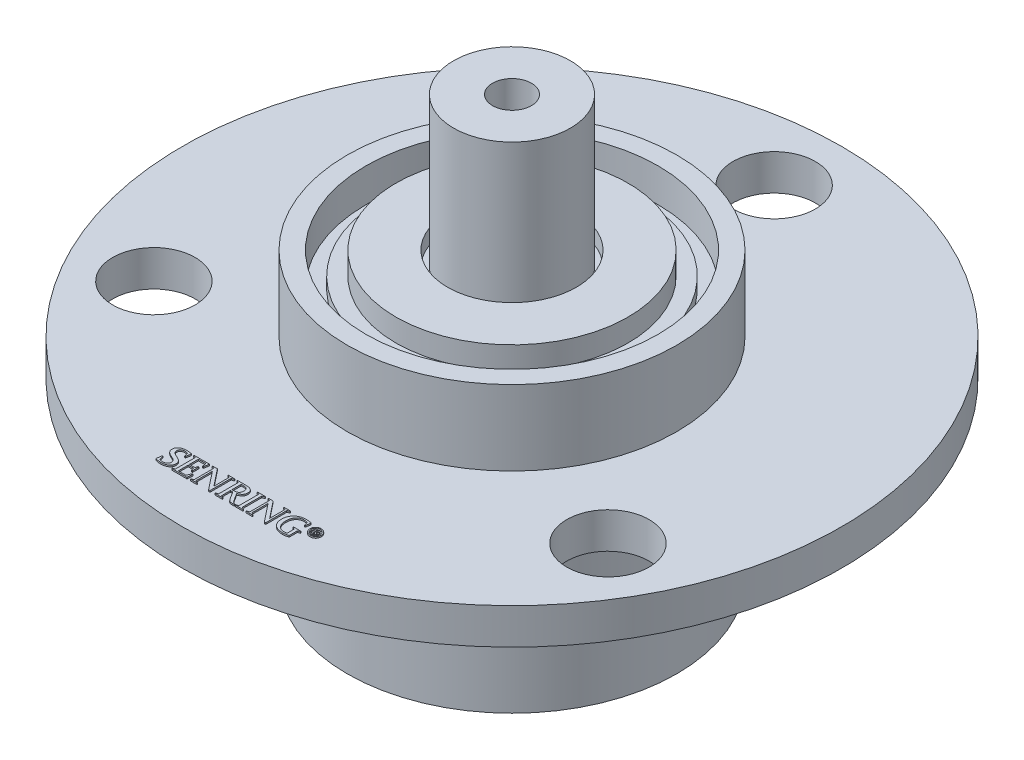
from build123d import *

# Parameters (mm, degrees)
SKETCH1_R           = 22
BOSS_EXTRUDE1_DEPTH = 2.4
SKETCH2_R           = 11
BOSS_EXTRUDE2_DEPTH = 5
BOSS_EXTRUDE3_START = 11.6
SKETCH3_R           = 11
BOSS_EXTRUDE3_DEPTH = 11.6
SKETCH4_R           = 2.75
CUT_EXTRUDE1_DEPTH  = 2.4
SKETCH5_R           = 9.75
SKETCH5_R_2         = 7.75
CUT_EXTRUDE2_DEPTH  = 1.5
SKETCH6_R           = 3.9
BOSS_EXTRUDE4_DEPTH = 9
SKETCH7_R           = 9.75
SKETCH7_R_2         = 8.75
CUT_EXTRUDE3_DEPTH  = 0.75
BOSS_EXTRUDE5_DEPTH = 0.1
SKETCH9_R           = 9.4
CUT_EXTRUDE4_DEPTH  = 0.3
CUT_EXTRUDE5_DEPTH  = 6
SKETCH11_R          = 1.3
CUT_EXTRUDE6_DEPTH  = 3
CUT_EXTRUDE7_START  = -1
SKETCH12_R          = 4.3
SKETCH12_R_2        = 3.9
CUT_EXTRUDE7_DEPTH  = 1


with BuildPart() as part:
    # Sketch1 → Boss-Extrude1 (new body)
    with BuildSketch(Plane(origin=(0, 0, 0), x_dir=(1, 0, 0), z_dir=(0, 1, 0))):
        with Locations(Location((0, 0, 0), (0, 0, 270))):
            Circle(SKETCH1_R)
    extrude(amount=BOSS_EXTRUDE1_DEPTH)

    # Sketch2 → Boss-Extrude2 (add)
    with BuildSketch(Plane(origin=(0, 2.4, 0), x_dir=(1, 0, 0), z_dir=(0, 1, 0))):
        with Locations(Location((0, 0, 0), (0, 0, 270))):
            Circle(SKETCH2_R)
    extrude(amount=BOSS_EXTRUDE2_DEPTH)

    # Sketch3 → Boss-Extrude3 (add)
    with BuildSketch(Plane.XZ.offset(BOSS_EXTRUDE3_START)):
        with Locations(Location((0, 0, 0), (0, 0, 90))):
            Circle(SKETCH3_R)
    extrude(amount=-BOSS_EXTRUDE3_DEPTH)

    # Sketch4 → Cut-Extrude1 (cut)
    with BuildSketch(Plane(origin=(0, 2.4, 0), x_dir=(1, 0, 0), z_dir=(0, 1, 0))):
        with Locations(Location((0, 17.5, 0), (0, 0, 270))):
            Circle(SKETCH4_R)
        with Locations(Location((15.155444566, -8.75, 0), (0, 0, 270))):
            Circle(SKETCH4_R)
        with Locations(Location((-15.155444566, -8.75, 0), (0, 0, 270))):
            Circle(SKETCH4_R)
    extrude(amount=-CUT_EXTRUDE1_DEPTH, mode=Mode.SUBTRACT)

    # Sketch5 → Cut-Extrude2 (cut)
    with BuildSketch(Plane(origin=(0, 7.4, 0), x_dir=(1, 0, 0), z_dir=(0, 1, 0))):
        with Locations(Location((0, 0, 0), (0, 0, 270))):
            Circle(SKETCH5_R)
        with Locations(Location((0, 0, 0), (0, 0, 270))):
            Circle(SKETCH5_R_2, mode=Mode.SUBTRACT)
    extrude(amount=-CUT_EXTRUDE2_DEPTH, mode=Mode.SUBTRACT)

    # Sketch6 → Boss-Extrude4 (add)
    with BuildSketch(Plane(origin=(0, 7.4, 0), x_dir=(1, 0, 0), z_dir=(0, 1, 0))):
        with Locations(Location((0, 0, 0), (0, 0, 270))):
            Circle(SKETCH6_R)
    extrude(amount=BOSS_EXTRUDE4_DEPTH)

    # Sketch7 → Cut-Extrude3 (cut)
    with BuildSketch(Plane(origin=(0, 5.9, 0), x_dir=(1, 0, 0), z_dir=(0, 1, 0))):
        with Locations(Location((0, 0, 0), (0, 0, 270))):
            Circle(SKETCH7_R)
        with Locations(Location((0, 0, 0), (0, 0, 270))):
            Circle(SKETCH7_R_2, mode=Mode.SUBTRACT)
    extrude(amount=-CUT_EXTRUDE3_DEPTH, mode=Mode.SUBTRACT)

    # Sketch8 → Boss-Extrude5 (add)
    # profile 1 of 9: a face of its own
    with BuildSketch(Plane(origin=(0, 2.4, 0), x_dir=(1, 0, 0), z_dir=(0, 1, 0))):
        with BuildLine():
            add(Edge.make_bspline(
                [(-3.990424377, -17.672699904), (-4.008373633, -17.667217667), (-4.043350728, -17.656534622), (-4.095515267, -17.645512525), (-4.145415963, -17.638028046), (-4.17800345, -17.637176703), (-4.193861877, -17.636762404)],
                knots=[0, 0, 0, 0, 1.085488502, 2.115253907, 3.082804142, 4, 4, 4, 4], degree=3))
            add(Edge.make_bspline(
                [(-4.193861877, -17.636762404), (-4.205224969, -17.63690072), (-4.227372066, -17.637170305), (-4.25961526, -17.640467874), (-4.290160656, -17.645303529), (-4.318859045, -17.652567871), (-4.345943562, -17.661480846), (-4.371034073, -17.672942141), (-4.394654563, -17.685922587), (-4.416082548, -17.701313676), (-4.435697457, -17.718127914), (-4.452528741, -17.736878609), (-4.466836132, -17.757266567), (-4.478683872, -17.779027132), (-4.487982435, -17.802506516), (-4.493913159, -17.82768726), (-4.498308032, -17.854318812), (-4.498674418, -17.872680339), (-4.498861877, -17.882074904)],
                knots=[0, 0, 0, 0, 1.234208642, 2.405519354, 3.51827187, 4.591643104, 5.618907388, 6.611863802, 7.584813727, 8.542701907, 9.473318954, 10.386986489, 11.272527839, 12.174055887, 13.073663442, 14.007029733, 14.980308792, 16, 16, 16, 16], degree=3))
            add(Edge.make_bspline(
                [(-4.498861877, -17.882074904), (-4.498502135, -17.893450959), (-4.497804877, -17.915500247), (-4.492387415, -17.947537955), (-4.483392207, -17.977429677), (-4.470453694, -18.005098959), (-4.45409719, -18.030528119), (-4.435829519, -18.05468965), (-4.414546246, -18.076959489), (-4.383020937, -18.105125419), (-4.337844345, -18.136442628), (-4.278379837, -18.169380926), (-4.214669942, -18.199673552), (-4.171179165, -18.219528836), (-4.149174377, -18.229574904)],
                knots=[0, 0, 0, 0, 0.778259039, 1.508436541, 2.216563713, 2.908683688, 3.591078706, 4.282647702, 4.978612309, 5.695584281, 7.173255772, 8.727829764, 10.344398109, 12, 12, 12, 12], degree=3))
            add(Edge.make_bspline(
                [(-4.149174377, -18.229574904), (-4.124924871, -18.240441003), (-4.076823274, -18.261995123), (-4.006857753, -18.297073887), (-3.940441984, -18.33527304), (-3.890594206, -18.373465105), (-3.854645948, -18.407193223), (-3.830813757, -18.435208947), (-3.809793714, -18.465687798), (-3.791590842, -18.49856442), (-3.77659605, -18.534047045), (-3.766493277, -18.572560974), (-3.760082151, -18.613735359), (-3.759276178, -18.642154065), (-3.758861877, -18.656762404)],
                knots=[0, 0, 0, 0, 1.543398054, 3.0615021, 4.545469272, 5.98688264, 6.697343335, 7.405507011, 8.118847824, 8.844680014, 9.585218838, 10.349959468, 11.151813912, 12, 12, 12, 12], degree=3))
            add(Edge.make_bspline(
                [(-3.758861877, -18.656762404), (-3.759254602, -18.674091193), (-3.76002105, -18.70791036), (-3.768539248, -18.756947358), (-3.781487496, -18.802991786), (-3.800062012, -18.845902855), (-3.824088693, -18.885486639), (-3.852956199, -18.922251682), (-3.887901203, -18.955018604), (-3.927196003, -18.984933588), (-3.970629315, -19.011370035), (-4.017383826, -19.03412655), (-4.066929975, -19.053510297), (-4.119240643, -19.069520903), (-4.17445209, -19.081577196), (-4.232492455, -19.090282611), (-4.293448013, -19.09567041), (-4.33510068, -19.096393374), (-4.356361877, -19.096762404)],
                knots=[0, 0, 0, 0, 0.995693307, 1.943212381, 2.853401529, 3.741575323, 4.623157416, 5.510178669, 6.421254701, 7.370287868, 8.346430534, 9.34050028, 10.357381684, 11.403528079, 12.483557003, 13.604551818, 14.777266867, 16, 16, 16, 16], degree=3))
            add(Edge.make_bspline(
                [(-4.356361877, -19.096762404), (-4.38514545, -19.095987848), (-4.444259911, -19.094397098), (-4.535064475, -19.082627706), (-4.630325585, -19.064801644), (-4.694589794, -19.047518384), (-4.727611877, -19.038637404)],
                knots=[0, 0, 0, 0, 0.916293707, 1.881844505, 2.911588482, 4, 4, 4, 4], degree=3))
            Line((-4.727611877, -19.038637404), (-4.733861877, -19.030199904))
            Line((-4.733861877, -19.030199904), (-4.682299377, -18.664262404))
            Line((-4.682299377, -18.664262404), (-4.634799377, -18.656762404))
            Line((-4.634799377, -18.656762404), (-4.561049377, -18.953012404))
            add(Edge.make_bspline(
                [(-4.561049377, -18.953012404), (-4.54240938, -18.959721483), (-4.505405189, -18.973040373), (-4.448133926, -18.986680179), (-4.390257612, -18.995053168), (-4.3513896, -18.99619327), (-4.331986877, -18.996762404)],
                knots=[0, 0, 0, 0, 1.013176663, 2.01136215, 3.007281639, 4, 4, 4, 4], degree=3))
            add(Edge.make_bspline(
                [(-4.331986877, -18.996762404), (-4.319268633, -18.996649912), (-4.294407055, -18.996430014), (-4.258317197, -18.992765706), (-4.224240493, -18.987618994), (-4.192506196, -18.980097936), (-4.162699376, -18.970815491), (-4.135337771, -18.958934643), (-4.110002894, -18.945046609), (-4.086800467, -18.929220042), (-4.066223991, -18.91108162), (-4.048164217, -18.891180565), (-4.032747721, -18.869526136), (-4.020074909, -18.84596042), (-4.010861264, -18.820395102), (-4.003980644, -18.793296143), (-3.999358629, -18.764419283), (-3.999030336, -18.74448926), (-3.998861877, -18.734262404)],
                knots=[0, 0, 0, 0, 1.270299755, 2.483177503, 3.621207158, 4.711934724, 5.739017396, 6.736776301, 7.687149045, 8.622641224, 9.537225582, 10.421574316, 11.302485812, 12.187263261, 13.086374941, 14.010388254, 14.979054274, 16, 16, 16, 16], degree=3))
            add(Edge.make_bspline(
                [(-3.998861877, -18.734262404), (-3.999231274, -18.723096309), (-3.999950307, -18.701361495), (-4.005267232, -18.669814464), (-4.014441691, -18.640438447), (-4.027051673, -18.613091858), (-4.042690865, -18.587768567), (-4.061135345, -18.564592264), (-4.081400056, -18.542670542), (-4.112979988, -18.516496152), (-4.156871071, -18.485957429), (-4.215392229, -18.454325331), (-4.277849194, -18.424086812), (-4.320602121, -18.404302838), (-4.342299377, -18.394262404)],
                knots=[0, 0, 0, 0, 0.779269004, 1.516847907, 2.225209504, 2.92148785, 3.61365338, 4.297325759, 4.98662073, 5.693300865, 7.155751331, 8.71165789, 10.331155278, 12, 12, 12, 12], degree=3))
            add(Edge.make_bspline(
                [(-4.342299377, -18.394262404), (-4.366858696, -18.38329546), (-4.415749003, -18.361463536), (-4.487006682, -18.325849562), (-4.553753093, -18.285039685), (-4.605073155, -18.246230964), (-4.641163297, -18.210538877), (-4.665903869, -18.181460911), (-4.686943268, -18.149010837), (-4.705680008, -18.114171747), (-4.7208246, -18.076213076), (-4.73134142, -18.034942633), (-4.73760607, -17.990704843), (-4.738435945, -17.960220779), (-4.738861877, -17.944574904)],
                knots=[0, 0, 0, 0, 1.505590493, 2.997183208, 4.45523457, 5.880494019, 6.585539522, 7.293280273, 8.012930273, 8.745897636, 9.504910951, 10.294054083, 11.12442722, 12, 12, 12, 12], degree=3))
            add(Edge.make_bspline(
                [(-4.738861877, -17.944574904), (-4.738434304, -17.928809355), (-4.737596247, -17.897908299), (-4.729474357, -17.853014445), (-4.716840539, -17.810665386), (-4.698375355, -17.771435745), (-4.675504193, -17.73456031), (-4.646659898, -17.701093922), (-4.612874233, -17.670304566), (-4.574517562, -17.642411169), (-4.532521306, -17.617694857), (-4.487864578, -17.5960413), (-4.440976758, -17.577587201), (-4.391849543, -17.562625338), (-4.340544821, -17.551078841), (-4.287008443, -17.542639947), (-4.231148199, -17.537569957), (-4.19314325, -17.537034209), (-4.173861877, -17.536762404)],
                knots=[0, 0, 0, 0, 0.969870177, 1.900981247, 2.799786438, 3.683637421, 4.562727952, 5.463658981, 6.394306014, 7.371865646, 8.378371075, 9.390988941, 10.424835136, 11.477842863, 12.549919072, 13.660298415, 14.812979307, 16, 16, 16, 16], degree=3))
            add(Edge.make_bspline(
                [(-4.173861877, -17.536762404), (-4.145719011, -17.537244462), (-4.088711992, -17.538220935), (-4.002378894, -17.546279246), (-3.913934286, -17.558063667), (-3.854840691, -17.570253154), (-3.824799377, -17.576449904)],
                knots=[0, 0, 0, 0, 0.959381208, 1.943350944, 2.954464664, 4, 4, 4, 4], degree=3))
            Line((-3.824799377, -17.576449904), (-3.817299377, -17.584262404))
            Line((-3.817299377, -17.584262404), (-3.879799377, -17.919887404))
            Line((-3.879799377, -17.919887404), (-3.921986877, -17.927387404))
            Line((-3.921986877, -17.927387404), (-3.990424377, -17.672699904))
        make_face()
    # profile 2 of 9: a face of its own
    with BuildSketch(Plane(origin=(0, 2.4, 0), x_dir=(1, 0, 0), z_dir=(0, 1, 0))):
        with BuildLine():
            Line((-3.381049377, -17.576762404), (-3.127924377, -17.576762404))
            add(Edge.make_bspline(
                [(-3.127924377, -17.576762404), (-3.088028506, -17.576673943), (-3.007090541, -17.57649448), (-2.884067988, -17.575926939), (-2.75771209, -17.574677707), (-2.672402999, -17.57336506), (-2.629174377, -17.572699904)],
                knots=[0, 0, 0, 0, 0.95986119, 1.947299551, 2.95983638, 4, 4, 4, 4], degree=3))
            Line((-2.629174377, -17.572699904), (-2.622611877, -17.581137404))
            Line((-2.622611877, -17.581137404), (-2.683861877, -17.916762404))
            Line((-2.683861877, -17.916762404), (-2.726049377, -17.923949904))
            Line((-2.726049377, -17.923949904), (-2.791361877, -17.656762404))
            Line((-2.791361877, -17.656762404), (-3.278861877, -17.656762404))
            Line((-3.278861877, -17.656762404), (-3.278861877, -18.256762404))
            Line((-3.278861877, -18.256762404), (-3.182924377, -18.256762404))
            add(Edge.make_bspline(
                [(-3.182924377, -18.256762404), (-3.164069854, -18.25682422), (-3.125422196, -18.256950931), (-3.065843292, -18.255944959), (-3.003128994, -18.256014914), (-2.960215414, -18.255269284), (-2.938236877, -18.254887404)],
                knots=[0, 0, 0, 0, 0.924608237, 1.895245239, 2.922032839, 4, 4, 4, 4], degree=3))
            add(Edge.make_bspline(
                [(-2.938236877, -18.254887404), (-2.934005966, -18.254530542), (-2.925938836, -18.253850111), (-2.915195358, -18.248592555), (-2.906707833, -18.240326329), (-2.903815018, -18.233066217), (-2.902299377, -18.229262404)],
                knots=[0, 0, 0, 0, 1.068716211, 2.037734312, 2.971903963, 4, 4, 4, 4], degree=3))
            Line((-2.902299377, -18.229262404), (-2.865424377, -18.096762404))
            Line((-2.865424377, -18.096762404), (-2.808236877, -18.094574904))
            add(Edge.make_bspline(
                [(-2.808236877, -18.094574904), (-2.808799338, -18.117386589), (-2.809844578, -18.159778298), (-2.810695354, -18.218532356), (-2.811383112, -18.267698608), (-2.811584377, -18.29728309), (-2.811674377, -18.310512404)],
                knots=[0, 0, 0, 0, 1.267879065, 2.356141637, 3.264914697, 4, 4, 4, 4], degree=3))
            add(Edge.make_bspline(
                [(-2.811674377, -18.310512404), (-2.811583882, -18.323429215), (-2.811380265, -18.352492859), (-2.810694777, -18.400929952), (-2.809843512, -18.459059037), (-2.808799222, -18.501034058), (-2.808236877, -18.523637404)],
                knots=[0, 0, 0, 0, 0.727191112, 1.636226109, 2.727119176, 4, 4, 4, 4], degree=3))
            Line((-2.808236877, -18.523637404), (-2.865424377, -18.527699904))
            Line((-2.865424377, -18.527699904), (-2.903236877, -18.370199904))
            add(Edge.make_bspline(
                [(-2.903236877, -18.370199904), (-2.904785897, -18.36572278), (-2.907654558, -18.357431508), (-2.914933625, -18.347199339), (-2.924739019, -18.340550534), (-2.932202472, -18.339494314), (-2.936049377, -18.338949904)],
                knots=[0, 0, 0, 0, 1.165841965, 2.159045699, 3.051112636, 4, 4, 4, 4], degree=3))
            add(Edge.make_bspline(
                [(-2.936049377, -18.338949904), (-2.958340704, -18.338606226), (-3.00188064, -18.337934946), (-3.065529223, -18.337475325), (-3.125839084, -18.336599867), (-3.164903256, -18.336709296), (-3.183861877, -18.336762404)],
                knots=[0, 0, 0, 0, 1.079495133, 2.108494915, 3.082014899, 4, 4, 4, 4], degree=3))
            Line((-3.183861877, -18.336762404), (-3.278861877, -18.336762404))
            Line((-3.278861877, -18.336762404), (-3.278861877, -18.748949904))
            add(Edge.make_bspline(
                [(-3.278861877, -18.748949904), (-3.278733812, -18.790513114), (-3.278479279, -18.873121482), (-3.27727349, -18.95572143), (-3.276674377, -18.996762404)],
                knots=[0, 0, 0, 0, 1.006271195, 2, 2, 2, 2], degree=3))
            Line((-3.276674377, -18.996762404), (-2.770424377, -18.996762404))
            Line((-2.770424377, -18.996762404), (-2.641674377, -18.704262404))
            Line((-2.641674377, -18.704262404), (-2.594174377, -18.695824904))
            Line((-2.594174377, -18.695824904), (-2.617611877, -19.072387404))
            Line((-2.617611877, -19.072387404), (-2.624799377, -19.079887404))
            add(Edge.make_bspline(
                [(-2.624799377, -19.079887404), (-2.669487071, -19.079499768), (-2.756987619, -19.078740759), (-2.885629231, -19.077133935), (-3.008966435, -19.077143092), (-3.089487001, -19.076887426), (-3.128861877, -19.076762404)],
                knots=[0, 0, 0, 0, 1.063875567, 2.083116964, 3.062636615, 4, 4, 4, 4], degree=3))
            Line((-3.128861877, -19.076762404), (-3.376674377, -19.076762404))
            add(Edge.make_bspline(
                [(-3.376674377, -19.076762404), (-3.418966043, -19.076762404), (-3.505111877, -19.076762404), (-3.59125771, -19.076762404), (-3.635111877, -19.076762404)],
                knots=[0, 0, 0, 0, 0.981862152, 2, 2, 2, 2], degree=3))
            Line((-3.635111877, -19.076762404), (-3.639174377, -19.036762404))
            Line((-3.639174377, -19.036762404), (-3.509486877, -18.996762404))
            add(Edge.make_bspline(
                [(-3.509486877, -18.996762404), (-3.505520348, -18.99531474), (-3.497988354, -18.992565789), (-3.488784833, -18.985108632), (-3.482644324, -18.975062913), (-3.481599182, -18.967371198), (-3.481049377, -18.963324904)],
                knots=[0, 0, 0, 0, 1.072356029, 2.036284212, 2.966969876, 4, 4, 4, 4], degree=3))
            add(Edge.make_bspline(
                [(-3.481049377, -18.963324904), (-3.480703834, -18.948117091), (-3.479974932, -18.916037133), (-3.479518942, -18.865199597), (-3.478670429, -18.808952199), (-3.478796068, -18.769575295), (-3.478861877, -18.748949904)],
                knots=[0, 0, 0, 0, 0.851424291, 1.796027954, 2.845572385, 4, 4, 4, 4], degree=3))
            Line((-3.478861877, -18.748949904), (-3.478861877, -17.874574904))
            add(Edge.make_bspline(
                [(-3.478861877, -17.874574904), (-3.478794862, -17.857178591), (-3.478667648, -17.824155459), (-3.479519262, -17.777075284), (-3.479972394, -17.734778495), (-3.480703689, -17.70811594), (-3.481049377, -17.695512404)],
                knots=[0, 0, 0, 0, 1.165661162, 2.212755269, 3.155159611, 4, 4, 4, 4], degree=3))
            add(Edge.make_bspline(
                [(-3.481049377, -17.695512404), (-3.481386368, -17.69116887), (-3.482021619, -17.682981021), (-3.487438281, -17.672145148), (-3.495432467, -17.663429194), (-3.502655567, -17.660468891), (-3.506361877, -17.658949904)],
                knots=[0, 0, 0, 0, 1.089053236, 2.052937975, 3.000925474, 4, 4, 4, 4], degree=3))
            Line((-3.506361877, -17.658949904), (-3.636986877, -17.616762404))
            Line((-3.636986877, -17.616762404), (-3.639174377, -17.576762404))
            add(Edge.make_bspline(
                [(-3.639174377, -17.576762404), (-3.59500771, -17.576762404), (-3.508966043, -17.576762404), (-3.422924377, -17.576762404), (-3.381049377, -17.576762404)],
                knots=[0, 0, 0, 0, 1.026634383, 2, 2, 2, 2], degree=3))
        make_face()
    # profile 3 of 9: a face of its own
    with BuildSketch(Plane(origin=(0, 2.4, 0), x_dir=(1, 0, 0), z_dir=(0, 1, 0))):
        with BuildLine():
            Line((-2.118861877, -17.882074904), (-2.118861877, -18.751449904))
            add(Edge.make_bspline(
                [(-2.118861877, -18.751449904), (-2.118927981, -18.771762805), (-2.119054091, -18.810514747), (-2.118202236, -18.865928724), (-2.117753, -18.915933105), (-2.117020231, -18.947492106), (-2.116674377, -18.962387404)],
                knots=[0, 0, 0, 0, 1.155460956, 2.204330929, 3.152475522, 4, 4, 4, 4], degree=3))
            add(Edge.make_bspline(
                [(-2.116674377, -18.962387404), (-2.116381217, -18.967051317), (-2.115837108, -18.975707602), (-2.110192916, -18.986820724), (-2.10175349, -18.995303194), (-2.094346383, -18.997687455), (-2.090424377, -18.998949904)],
                knots=[0, 0, 0, 0, 1.13809326, 2.112316129, 3.00048572, 4, 4, 4, 4], degree=3))
            Line((-2.090424377, -18.998949904), (-1.964799377, -19.036762404))
            Line((-1.964799377, -19.036762404), (-1.962924377, -19.076762404))
            add(Edge.make_bspline(
                [(-1.962924377, -19.076762404), (-1.983862525, -19.076385537), (-2.023656294, -19.075669288), (-2.080416692, -19.074032201), (-2.131154404, -19.074023309), (-2.163028787, -19.073760309), (-2.177924377, -19.073637404)],
                knots=[0, 0, 0, 0, 1.168682208, 2.221126205, 3.168693739, 4, 4, 4, 4], degree=3))
            add(Edge.make_bspline(
                [(-2.177924377, -19.073637404), (-2.192507478, -19.07375984), (-2.224069364, -19.074024826), (-2.274806879, -19.074038098), (-2.332504788, -19.075680697), (-2.373236194, -19.076387972), (-2.394799377, -19.076762404)],
                knots=[0, 0, 0, 0, 0.806833825, 1.746212635, 2.806846289, 4, 4, 4, 4], degree=3))
            Line((-2.394799377, -19.076762404), (-2.399174377, -19.036762404))
            Line((-2.399174377, -19.036762404), (-2.269174377, -18.996762404))
            add(Edge.make_bspline(
                [(-2.269174377, -18.996762404), (-2.265102649, -18.99520717), (-2.257486774, -18.992298216), (-2.24817385, -18.984802682), (-2.242015634, -18.974870425), (-2.24117345, -18.967266594), (-2.240736877, -18.963324904)],
                knots=[0, 0, 0, 0, 1.106377687, 2.069400312, 2.999211647, 4, 4, 4, 4], degree=3))
            add(Edge.make_bspline(
                [(-2.240736877, -18.963324904), (-2.240398307, -18.947908692), (-2.239686901, -18.915516025), (-2.239108927, -18.86436795), (-2.238791324, -18.808325329), (-2.23883774, -18.76926245), (-2.238861877, -18.748949904)],
                knots=[0, 0, 0, 0, 0.863093851, 1.813539741, 2.863049087, 4, 4, 4, 4], degree=3))
            Line((-2.238861877, -18.748949904), (-2.238861877, -17.874574904))
            add(Edge.make_bspline(
                [(-2.238861877, -17.874574904), (-2.238837334, -17.857387343), (-2.23879033, -17.824470216), (-2.239109394, -17.777385789), (-2.239676856, -17.734882808), (-2.240397534, -17.708116002), (-2.240736877, -17.695512404)],
                knots=[0, 0, 0, 0, 1.151721508, 2.205744304, 3.155144676, 4, 4, 4, 4], degree=3))
            add(Edge.make_bspline(
                [(-2.240736877, -17.695512404), (-2.241238879, -17.691189029), (-2.242178383, -17.68309777), (-2.247046235, -17.672065223), (-2.255149203, -17.66344152), (-2.262352981, -17.660473071), (-2.266049377, -17.658949904)],
                knots=[0, 0, 0, 0, 1.095100481, 2.049496461, 2.999159568, 4, 4, 4, 4], degree=3))
            Line((-2.266049377, -17.658949904), (-2.396986877, -17.616762404))
            Line((-2.396986877, -17.616762404), (-2.399174377, -17.576762404))
            add(Edge.make_bspline(
                [(-2.399174377, -17.576762404), (-2.377612942, -17.577430806), (-2.336993402, -17.578690008), (-2.279591956, -17.579816097), (-2.229386776, -17.580931366), (-2.19823738, -17.581072343), (-2.183861877, -17.581137404)],
                knots=[0, 0, 0, 0, 1.201963383, 2.264376297, 3.199006451, 4, 4, 4, 4], degree=3))
            add(Edge.make_bspline(
                [(-2.183861877, -17.581137404), (-2.16791752, -17.580872059), (-2.13579233, -17.580337434), (-2.103750648, -17.577959914), (-2.087611877, -17.576762404)],
                knots=[0, 0, 0, 0, 0.992638928, 2, 2, 2, 2], degree=3))
            Line((-2.087611877, -17.576762404), (-1.198861877, -18.700824904))
            Line((-1.198861877, -18.700824904), (-1.198861877, -17.867387404))
            add(Edge.make_bspline(
                [(-1.198861877, -17.867387404), (-1.198797706, -17.850511948), (-1.198674114, -17.818009683), (-1.199525854, -17.771137826), (-1.199983715, -17.7279039), (-1.200704103, -17.700303475), (-1.201049377, -17.687074904)],
                knots=[0, 0, 0, 0, 1.122927161, 2.162766949, 3.119434984, 4, 4, 4, 4], degree=3))
            add(Edge.make_bspline(
                [(-1.201049377, -17.687074904), (-1.201539071, -17.68316213), (-1.202470913, -17.675716503), (-1.207753044, -17.665537245), (-1.216869272, -17.658117136), (-1.224277501, -17.65519771), (-1.228236877, -17.653637404)],
                knots=[0, 0, 0, 0, 1.018818456, 1.938712073, 2.89833145, 4, 4, 4, 4], degree=3))
            Line((-1.228236877, -17.653637404), (-1.352924377, -17.616762404))
            Line((-1.352924377, -17.616762404), (-1.354799377, -17.576762404))
            add(Edge.make_bspline(
                [(-1.354799377, -17.576762404), (-1.333446134, -17.577419949), (-1.292826639, -17.578670773), (-1.235324611, -17.579941011), (-1.184383852, -17.580537752), (-1.152716131, -17.58073348), (-1.137924377, -17.580824904)],
                knots=[0, 0, 0, 0, 1.181812028, 2.248117968, 3.181709099, 4, 4, 4, 4], degree=3))
            add(Edge.make_bspline(
                [(-1.137924377, -17.580824904), (-1.123028459, -17.580733468), (-1.091256574, -17.580538441), (-1.040523961, -17.579949568), (-0.983751088, -17.578673194), (-0.943860928, -17.577420098), (-0.922924377, -17.576762404)],
                knots=[0, 0, 0, 0, 0.831235264, 1.77296311, 2.831128506, 4, 4, 4, 4], degree=3))
            Line((-0.922924377, -17.576762404), (-0.918549377, -17.616762404))
            Line((-0.918549377, -17.616762404), (-1.051674377, -17.658637404))
            add(Edge.make_bspline(
                [(-1.051674377, -17.658637404), (-1.055343867, -17.660300167), (-1.062385685, -17.66349104), (-1.070779518, -17.67174472), (-1.07552418, -17.682808141), (-1.076477495, -17.690884494), (-1.076986877, -17.695199904)],
                knots=[0, 0, 0, 0, 1.014601308, 1.947038455, 2.903048032, 4, 4, 4, 4], degree=3))
            add(Edge.make_bspline(
                [(-1.076986877, -17.695199904), (-1.077362234, -17.707803112), (-1.078159363, -17.73456794), (-1.078074935, -17.776973706), (-1.07909051, -17.823946734), (-1.078940467, -17.856761791), (-1.078861877, -17.873949904)],
                knots=[0, 0, 0, 0, 0.846333692, 1.797318252, 2.846263156, 4, 4, 4, 4], degree=3))
            Line((-1.078861877, -17.873949904), (-1.078861877, -19.076762404))
            Line((-1.078861877, -19.076762404), (-1.167611877, -19.085199904))
            Line((-1.167611877, -19.085199904), (-2.118861877, -17.882074904))
        make_face()
    # profile 4 of 9: a face of its own
    with BuildSketch(Plane(origin=(0, 2.4, 0), x_dir=(1, 0, 0), z_dir=(0, 1, 0))):
        with BuildLine():
            add(Edge.make_bspline(
                [(-0.398861877, -18.757699904), (-0.398753209, -18.777491543), (-0.398546739, -18.815095717), (-0.398322169, -18.868638924), (-0.397723869, -18.916766325), (-0.397011994, -18.947075392), (-0.396674377, -18.961449904)],
                knots=[0, 0, 0, 0, 1.16556873, 2.214583996, 3.153240739, 4, 4, 4, 4], degree=3))
            add(Edge.make_bspline(
                [(-0.396674377, -18.961449904), (-0.396221865, -18.966405112), (-0.395372923, -18.975701414), (-0.389957822, -18.988153439), (-0.381036055, -18.997686314), (-0.373201638, -19.000791296), (-0.369174377, -19.002387404)],
                knots=[0, 0, 0, 0, 1.12342583, 2.107622107, 3.027228327, 4, 4, 4, 4], degree=3))
            Line((-0.369174377, -19.002387404), (-0.252299377, -19.036762404))
            Line((-0.252299377, -19.036762404), (-0.248861877, -19.076762404))
            add(Edge.make_bspline(
                [(-0.248861877, -19.076762404), (-0.29042241, -19.075772496), (-0.373014949, -19.073805268), (-0.455630793, -19.073693119), (-0.496674377, -19.073637404)],
                knots=[0, 0, 0, 0, 1.006399206, 2, 2, 2, 2], degree=3))
            add(Edge.make_bspline(
                [(-0.496674377, -19.073637404), (-0.538967791, -19.073699655), (-0.625124569, -19.073826468), (-0.71125959, -19.075771942), (-0.755111877, -19.076762404)],
                knots=[0, 0, 0, 0, 0.98177799, 2, 2, 2, 2], degree=3))
            Line((-0.755111877, -19.076762404), (-0.759174377, -19.036762404))
            Line((-0.759174377, -19.036762404), (-0.629486877, -18.996762404))
            add(Edge.make_bspline(
                [(-0.629486877, -18.996762404), (-0.625520348, -18.99531474), (-0.617988354, -18.992565789), (-0.608784833, -18.985108632), (-0.602644324, -18.975062913), (-0.601599182, -18.967371198), (-0.601049377, -18.963324904)],
                knots=[0, 0, 0, 0, 1.072356029, 2.036284212, 2.966969876, 4, 4, 4, 4], degree=3))
            add(Edge.make_bspline(
                [(-0.601049377, -18.963324904), (-0.600703834, -18.948117091), (-0.599974932, -18.916037133), (-0.599518942, -18.865199597), (-0.598670429, -18.808952199), (-0.598796068, -18.769575295), (-0.598861877, -18.748949904)],
                knots=[0, 0, 0, 0, 0.851424291, 1.796027954, 2.845572385, 4, 4, 4, 4], degree=3))
            Line((-0.598861877, -18.748949904), (-0.598861877, -17.874574904))
            add(Edge.make_bspline(
                [(-0.598861877, -17.874574904), (-0.598794862, -17.857178591), (-0.598667648, -17.824155459), (-0.599519262, -17.777075284), (-0.599972394, -17.734778495), (-0.600703689, -17.70811594), (-0.601049377, -17.695512404)],
                knots=[0, 0, 0, 0, 1.165661162, 2.212755269, 3.155159611, 4, 4, 4, 4], degree=3))
            add(Edge.make_bspline(
                [(-0.601049377, -17.695512404), (-0.601386368, -17.69116887), (-0.602021619, -17.682981021), (-0.607438281, -17.672145148), (-0.615432467, -17.663429194), (-0.622655567, -17.660468891), (-0.626361877, -17.658949904)],
                knots=[0, 0, 0, 0, 1.089053236, 2.052937975, 3.000925474, 4, 4, 4, 4], degree=3))
            Line((-0.626361877, -17.658949904), (-0.756986877, -17.616762404))
            Line((-0.756986877, -17.616762404), (-0.759174377, -17.576762404))
            add(Edge.make_bspline(
                [(-0.759174377, -17.576762404), (-0.714281306, -17.577986557), (-0.625235063, -17.580414687), (-0.536156215, -17.580688924), (-0.491986877, -17.580824904)],
                knots=[0, 0, 0, 0, 1.008309156, 2, 2, 2, 2], degree=3))
            add(Edge.make_bspline(
                [(-0.491986877, -17.580824904), (-0.482194022, -17.580773989), (-0.460309871, -17.580660209), (-0.423653751, -17.579132055), (-0.379187411, -17.577421141), (-0.346780725, -17.576994302), (-0.329174377, -17.576762404)],
                knots=[0, 0, 0, 0, 0.721468326, 1.612269701, 2.702761104, 4, 4, 4, 4], degree=3))
            add(Edge.make_bspline(
                [(-0.329174377, -17.576762404), (-0.311361877, -17.576762404), (-0.27907021, -17.576762404), (-0.235111877, -17.576762404), (-0.200111877, -17.576762404), (-0.179591043, -17.576762404), (-0.170736877, -17.576762404)],
                knots=[0, 0, 0, 0, 1.349112426, 2.445759369, 3.32938856, 4, 4, 4, 4], degree=3))
            add(Edge.make_bspline(
                [(-0.170736877, -17.576762404), (-0.150832605, -17.577064539), (-0.112327888, -17.577649019), (-0.056502589, -17.582067023), (-0.004521454, -17.589173666), (0.043717468, -17.598939997), (0.088019222, -17.612127588), (0.128520299, -17.628044781), (0.165403614, -17.646628434), (0.198011126, -17.668756857), (0.227143353, -17.693181813), (0.252240894, -17.720568959), (0.273752771, -17.750518184), (0.291380528, -17.783246383), (0.304851898, -17.818781053), (0.313964936, -17.856927057), (0.320266068, -17.897492183), (0.320841907, -17.925486734), (0.321138123, -17.939887404)],
                knots=[0, 0, 0, 0, 1.373939338, 2.657878926, 3.862977708, 4.994036763, 6.051984536, 7.049479102, 7.994998342, 8.896479064, 9.763814478, 10.613714993, 11.453824405, 12.303207606, 13.172627177, 14.069074787, 15.006713304, 16, 16, 16, 16], degree=3))
            add(Edge.make_bspline(
                [(0.321138123, -17.939887404), (0.32092217, -17.952917338), (0.320497794, -17.978522761), (0.31646014, -18.015967437), (0.309371066, -18.051396608), (0.300636599, -18.085157875), (0.288194616, -18.116722776), (0.273595873, -18.146673849), (0.25592219, -18.174503937), (0.23590218, -18.200713078), (0.21274214, -18.224751566), (0.187302616, -18.247806023), (0.158922391, -18.269335296), (0.127377484, -18.288970053), (0.093299074, -18.307323185), (0.056572903, -18.32467282), (0.016880452, -18.340266565), (-0.010890621, -18.349109193), (-0.025111877, -18.353637404)],
                knots=[0, 0, 0, 0, 1.066375877, 2.09555964, 3.077161004, 4.022426913, 4.945591025, 5.849334685, 6.745930503, 7.639602367, 8.544310879, 9.474066861, 10.447822873, 11.455591219, 12.512413436, 13.614760254, 14.778545442, 16, 16, 16, 16], degree=3))
            add(Edge.make_bspline(
                [(-0.025111877, -18.353637404), (-0.002816361, -18.38672899), (0.04066779, -18.451269303), (0.100445763, -18.547510699), (0.156486722, -18.637428822), (0.200434199, -18.707985399), (0.233768738, -18.760213164), (0.257229382, -18.796069498), (0.279363608, -18.829749114), (0.300131002, -18.861160902), (0.320425446, -18.889451694), (0.339616188, -18.914920464), (0.358490036, -18.936867203), (0.371088607, -18.950141685), (0.377075623, -18.956449904)],
                knots=[0, 0, 0, 0, 1.979920897, 3.861546963, 5.621521729, 7.237935787, 7.986456609, 8.696166828, 9.364277827, 9.986498717, 10.564574258, 11.09186048, 11.568439417, 12, 12, 12, 12], degree=3))
            add(Edge.make_bspline(
                [(0.377075623, -18.956449904), (0.382926754, -18.96216747), (0.394236194, -18.973218748), (0.412190974, -18.98786312), (0.430810105, -18.999770784), (0.450131818, -19.009750353), (0.470634087, -19.017114796), (0.491826841, -19.024749541), (0.51494171, -19.030725692), (0.530927815, -19.034693533), (0.539263123, -19.036762404)],
                knots=[0, 0, 0, 0, 1.066453224, 2.06130902, 3.01449663, 3.943871608, 4.889773601, 5.851918761, 6.879969814, 8, 8, 8, 8], degree=3))
            Line((0.539263123, -19.036762404), (0.542388123, -19.069887404))
            add(Edge.make_bspline(
                [(0.542388123, -19.069887404), (0.530207645, -19.071032244), (0.50701435, -19.073212177), (0.473532543, -19.074734045), (0.443243206, -19.076720842), (0.423953548, -19.076749116), (0.414888123, -19.076762404)],
                knots=[0, 0, 0, 0, 1.149186279, 2.188207784, 3.148524834, 4, 4, 4, 4], degree=3))
            add(Edge.make_bspline(
                [(0.414888123, -19.076762404), (0.401347559, -19.076576052), (0.375927059, -19.076226204), (0.340023582, -19.075404189), (0.308388797, -19.072240319), (0.280179827, -19.067460862), (0.254989726, -19.060004427), (0.231656463, -19.051393063), (0.209989121, -19.039769186), (0.196472317, -19.030535975), (0.189575623, -19.025824904)],
                knots=[0, 0, 0, 0, 1.380324856, 2.591365151, 3.658322977, 4.618350237, 5.502084813, 6.33215299, 7.149012595, 8, 8, 8, 8], degree=3))
            add(Edge.make_bspline(
                [(0.189575623, -19.025824904), (0.18195761, -19.020135335), (0.166186426, -19.008356512), (0.143965388, -18.987112116), (0.122269549, -18.962276058), (0.092252483, -18.923997213), (0.055523711, -18.869305795), (0.009989522, -18.798226097), (-0.037015444, -18.720714104), (-0.085766113, -18.638826687), (-0.13634053, -18.554953945), (-0.17320717, -18.500359705), (-0.191674377, -18.473012404)],
                knots=[0, 0, 0, 0, 0.422669588, 0.875031247, 1.364135484, 1.888822465, 3.037944898, 4.292504576, 5.644318377, 7.070000119, 8.532306861, 10, 10, 10, 10], degree=3))
            add(Edge.make_bspline(
                [(-0.191674377, -18.473012404), (-0.19670703, -18.465667635), (-0.205686338, -18.45256303), (-0.218891578, -18.435346312), (-0.230967381, -18.421577813), (-0.244501731, -18.411629572), (-0.259777262, -18.40448213), (-0.277618234, -18.400245797), (-0.299016697, -18.397967893), (-0.314585427, -18.397193005), (-0.323236877, -18.396762404)],
                knots=[0, 0, 0, 0, 1.317495967, 2.350688577, 3.212640675, 4.017539648, 4.817698653, 5.692790188, 6.71789732, 8, 8, 8, 8], degree=3))
            Line((-0.323236877, -18.396762404), (-0.398861877, -18.394887404))
            Line((-0.398861877, -18.394887404), (-0.398861877, -18.757699904))
        make_face()
        with BuildLine():
            add(Edge.make_bspline(
                [(-0.398861877, -18.293637404), (-0.377822786, -18.294468016), (-0.337420169, -18.296063091), (-0.296989058, -18.296535835), (-0.277611877, -18.296762404)],
                knots=[0, 0, 0, 0, 1.041471719, 2, 2, 2, 2], degree=3))
            add(Edge.make_bspline(
                [(-0.277611877, -18.296762404), (-0.262605717, -18.296508183), (-0.233593923, -18.296016692), (-0.191717285, -18.292670003), (-0.152948514, -18.286788382), (-0.117329703, -18.278359528), (-0.084598586, -18.26786939), (-0.054990767, -18.254757418), (-0.028610996, -18.239049873), (-0.005020744, -18.221095831), (0.015375296, -18.200277458), (0.03306491, -18.176827405), (0.048157974, -18.150735509), (0.060287757, -18.121828058), (0.069606632, -18.090255285), (0.076469501, -18.056072958), (0.080536462, -18.019152876), (0.080933595, -17.993647827), (0.081138123, -17.980512404)],
                knots=[0, 0, 0, 0, 1.305684408, 2.524313152, 3.652377692, 4.714230734, 5.705956491, 6.639127356, 7.525153036, 8.371777779, 9.21138698, 10.052511415, 10.921545616, 11.827241249, 12.773525228, 13.78139704, 14.857391325, 16, 16, 16, 16], degree=3))
            add(Edge.make_bspline(
                [(0.081138123, -17.980512404), (0.080952494, -17.967790033), (0.080592378, -17.943108926), (0.076283746, -17.907517382), (0.070281068, -17.874397733), (0.061304182, -17.843942274), (0.049299103, -17.816388109), (0.035242169, -17.791228815), (0.0181767, -17.768958532), (-0.0013522, -17.748994976), (-0.023774905, -17.731693231), (-0.049069832, -17.717003602), (-0.077141431, -17.704452042), (-0.108119749, -17.69417667), (-0.142154949, -17.68647285), (-0.179028189, -17.680958118), (-0.218796421, -17.677487634), (-0.246250333, -17.67700934), (-0.260424377, -17.676762404)],
                knots=[0, 0, 0, 0, 1.157306971, 2.245149082, 3.258555241, 4.21843618, 5.127231179, 5.98922298, 6.834949821, 7.672989047, 8.524488835, 9.404183157, 10.329300276, 11.318694509, 12.369721108, 13.501423902, 14.710022588, 16, 16, 16, 16], degree=3))
            add(Edge.make_bspline(
                [(-0.260424377, -17.676762404), (-0.270738669, -17.67691194), (-0.292210621, -17.67722324), (-0.325550186, -17.67889535), (-0.361409454, -17.681307637), (-0.386056396, -17.683869086), (-0.398861877, -17.685199904)],
                knots=[0, 0, 0, 0, 0.892071271, 1.8570843, 2.886634063, 4, 4, 4, 4], degree=3))
            Line((-0.398861877, -17.685199904), (-0.398861877, -18.293637404))
        make_face(mode=Mode.SUBTRACT)
    # profile 5 of 9: a face of its own
    with BuildSketch(Plane(origin=(0, 2.4, 0), x_dir=(1, 0, 0), z_dir=(0, 1, 0))):
        with BuildLine():
            add(Edge.make_bspline(
                [(0.961138123, -18.748949904), (0.961246957, -18.76947071), (0.96145468, -18.808637376), (0.961678512, -18.864576353), (0.962278824, -18.915203574), (0.962988228, -18.947179529), (0.963325623, -18.962387404)],
                knots=[0, 0, 0, 0, 1.153666349, 2.201924412, 3.144829081, 4, 4, 4, 4], degree=3))
            add(Edge.make_bspline(
                [(0.963325623, -18.962387404), (0.963922916, -18.966673801), (0.965085932, -18.975020043), (0.972969234, -18.985960787), (0.985063858, -18.994050056), (0.994880984, -18.997227909), (1.000200623, -18.998949904)],
                knots=[0, 0, 0, 0, 0.918546395, 1.788543708, 2.801670725, 4, 4, 4, 4], degree=3))
            Line((1.000200623, -18.998949904), (1.119575623, -19.036762404))
            Line((1.119575623, -19.036762404), (1.121450623, -19.076762404))
            add(Edge.make_bspline(
                [(1.121450623, -19.076762404), (1.077285834, -19.075771582), (0.991254758, -19.073841504), (0.905202311, -19.073704214), (0.863325623, -19.073637404)],
                knots=[0, 0, 0, 0, 1.02671712, 2, 2, 2, 2], degree=3))
            add(Edge.make_bspline(
                [(0.863325623, -19.073637404), (0.821032209, -19.073699655), (0.734875431, -19.073826468), (0.64874041, -19.075771942), (0.604888123, -19.076762404)],
                knots=[0, 0, 0, 0, 0.98177799, 2, 2, 2, 2], degree=3))
            Line((0.604888123, -19.076762404), (0.600825623, -19.036762404))
            Line((0.600825623, -19.036762404), (0.730513123, -18.996762404))
            add(Edge.make_bspline(
                [(0.730513123, -18.996762404), (0.734479652, -18.99531474), (0.742011646, -18.992565789), (0.751215167, -18.985108632), (0.757355676, -18.975062913), (0.758400818, -18.967371198), (0.758950623, -18.963324904)],
                knots=[0, 0, 0, 0, 1.072356029, 2.036284212, 2.966969876, 4, 4, 4, 4], degree=3))
            add(Edge.make_bspline(
                [(0.758950623, -18.963324904), (0.759296166, -18.948117091), (0.760025068, -18.916037133), (0.760481058, -18.865199597), (0.761329571, -18.808952199), (0.761203932, -18.769575295), (0.761138123, -18.748949904)],
                knots=[0, 0, 0, 0, 0.851424291, 1.796027954, 2.845572385, 4, 4, 4, 4], degree=3))
            Line((0.761138123, -18.748949904), (0.761138123, -17.874574904))
            add(Edge.make_bspline(
                [(0.761138123, -17.874574904), (0.761205138, -17.857178591), (0.761332352, -17.824155459), (0.760480738, -17.777075284), (0.760027606, -17.734778495), (0.759296311, -17.70811594), (0.758950623, -17.695512404)],
                knots=[0, 0, 0, 0, 1.165661162, 2.212755269, 3.155159611, 4, 4, 4, 4], degree=3))
            add(Edge.make_bspline(
                [(0.758950623, -17.695512404), (0.758613632, -17.69116887), (0.757978381, -17.682981021), (0.752561719, -17.672145148), (0.744567533, -17.663429194), (0.737344433, -17.660468891), (0.733638123, -17.658949904)],
                knots=[0, 0, 0, 0, 1.089053236, 2.052937975, 3.000925474, 4, 4, 4, 4], degree=3))
            Line((0.733638123, -17.658949904), (0.603013123, -17.616762404))
            Line((0.603013123, -17.616762404), (0.600825623, -17.576762404))
            add(Edge.make_bspline(
                [(0.600825623, -17.576762404), (0.644989453, -17.577986829), (0.731015118, -17.580371857), (0.817073075, -17.580676607), (0.858950623, -17.580824904)],
                knots=[0, 0, 0, 0, 1.026759394, 2, 2, 2, 2], degree=3))
            add(Edge.make_bspline(
                [(0.858950623, -17.580824904), (0.901036544, -17.580678996), (0.987198771, -17.580380281), (1.073328462, -17.577986793), (1.117388123, -17.576762404)],
                knots=[0, 0, 0, 0, 0.976899564, 2, 2, 2, 2], degree=3))
            Line((1.117388123, -17.576762404), (1.121450623, -17.616762404))
            Line((1.121450623, -17.616762404), (0.990825623, -17.656762404))
            add(Edge.make_bspline(
                [(0.990825623, -17.656762404), (0.986920796, -17.657933473), (0.979506747, -17.66015697), (0.970961764, -17.668092565), (0.964910002, -17.67814849), (0.963871885, -17.686044821), (0.963325623, -17.690199904)],
                knots=[0, 0, 0, 0, 1.036961333, 1.968866402, 2.93120901, 4, 4, 4, 4], degree=3))
            add(Edge.make_bspline(
                [(0.963325623, -17.690199904), (0.962988431, -17.703324375), (0.962281999, -17.730820704), (0.961685539, -17.773844082), (0.961454195, -17.820720766), (0.961246586, -17.853220767), (0.961138123, -17.870199904)],
                knots=[0, 0, 0, 0, 0.875161947, 1.833501708, 2.868145522, 4, 4, 4, 4], degree=3))
            Line((0.961138123, -17.870199904), (0.961138123, -18.748949904))
        make_face()
    # profile 6 of 9: a face of its own
    with BuildSketch(Plane(origin=(0, 2.4, 0), x_dir=(1, 0, 0), z_dir=(0, 1, 0))):
        with BuildLine():
            Line((1.601138123, -17.882074904), (1.601138123, -18.751449904))
            add(Edge.make_bspline(
                [(1.601138123, -18.751449904), (1.601072019, -18.771762805), (1.600945909, -18.810514747), (1.601797764, -18.865928724), (1.602247, -18.915933105), (1.602979769, -18.947492106), (1.603325623, -18.962387404)],
                knots=[0, 0, 0, 0, 1.155460956, 2.204330929, 3.152475522, 4, 4, 4, 4], degree=3))
            add(Edge.make_bspline(
                [(1.603325623, -18.962387404), (1.603618783, -18.967051317), (1.604162892, -18.975707602), (1.609807084, -18.986820724), (1.61824651, -18.995303194), (1.625653617, -18.997687455), (1.629575623, -18.998949904)],
                knots=[0, 0, 0, 0, 1.13809326, 2.112316129, 3.00048572, 4, 4, 4, 4], degree=3))
            Line((1.629575623, -18.998949904), (1.755200623, -19.036762404))
            Line((1.755200623, -19.036762404), (1.757075623, -19.076762404))
            add(Edge.make_bspline(
                [(1.757075623, -19.076762404), (1.736137475, -19.076385537), (1.696343706, -19.075669288), (1.639583308, -19.074032201), (1.588845596, -19.074023309), (1.556971213, -19.073760309), (1.542075623, -19.073637404)],
                knots=[0, 0, 0, 0, 1.168682208, 2.221126205, 3.168693739, 4, 4, 4, 4], degree=3))
            add(Edge.make_bspline(
                [(1.542075623, -19.073637404), (1.527492522, -19.07375984), (1.495930636, -19.074024826), (1.445193121, -19.074038098), (1.387495212, -19.075680697), (1.346763806, -19.076387972), (1.325200623, -19.076762404)],
                knots=[0, 0, 0, 0, 0.806833825, 1.746212635, 2.806846289, 4, 4, 4, 4], degree=3))
            Line((1.325200623, -19.076762404), (1.320825623, -19.036762404))
            Line((1.320825623, -19.036762404), (1.450825623, -18.996762404))
            add(Edge.make_bspline(
                [(1.450825623, -18.996762404), (1.454897351, -18.99520717), (1.462513226, -18.992298216), (1.47182615, -18.984802682), (1.477984366, -18.974870425), (1.47882655, -18.967266594), (1.479263123, -18.963324904)],
                knots=[0, 0, 0, 0, 1.106377687, 2.069400312, 2.999211647, 4, 4, 4, 4], degree=3))
            add(Edge.make_bspline(
                [(1.479263123, -18.963324904), (1.479601693, -18.947908692), (1.480313099, -18.915516025), (1.480891073, -18.86436795), (1.481208676, -18.808325329), (1.48116226, -18.76926245), (1.481138123, -18.748949904)],
                knots=[0, 0, 0, 0, 0.863093851, 1.813539741, 2.863049087, 4, 4, 4, 4], degree=3))
            Line((1.481138123, -18.748949904), (1.481138123, -17.874574904))
            add(Edge.make_bspline(
                [(1.481138123, -17.874574904), (1.481162666, -17.857387343), (1.48120967, -17.824470216), (1.480890606, -17.777385789), (1.480323144, -17.734882808), (1.479602466, -17.708116002), (1.479263123, -17.695512404)],
                knots=[0, 0, 0, 0, 1.151721508, 2.205744304, 3.155144676, 4, 4, 4, 4], degree=3))
            add(Edge.make_bspline(
                [(1.479263123, -17.695512404), (1.478761121, -17.691189029), (1.477821617, -17.68309777), (1.472953765, -17.672065223), (1.464850797, -17.66344152), (1.457647019, -17.660473071), (1.453950623, -17.658949904)],
                knots=[0, 0, 0, 0, 1.095100481, 2.049496461, 2.999159568, 4, 4, 4, 4], degree=3))
            Line((1.453950623, -17.658949904), (1.323013123, -17.616762404))
            Line((1.323013123, -17.616762404), (1.320825623, -17.576762404))
            add(Edge.make_bspline(
                [(1.320825623, -17.576762404), (1.342387058, -17.577430806), (1.383006598, -17.578690008), (1.440408044, -17.579816097), (1.490613224, -17.580931366), (1.52176262, -17.581072343), (1.536138123, -17.581137404)],
                knots=[0, 0, 0, 0, 1.201963383, 2.264376297, 3.199006451, 4, 4, 4, 4], degree=3))
            add(Edge.make_bspline(
                [(1.536138123, -17.581137404), (1.55208248, -17.580872059), (1.58420767, -17.580337434), (1.616249352, -17.577959914), (1.632388123, -17.576762404)],
                knots=[0, 0, 0, 0, 0.992638928, 2, 2, 2, 2], degree=3))
            Line((1.632388123, -17.576762404), (2.521138123, -18.700824904))
            Line((2.521138123, -18.700824904), (2.521138123, -17.867387404))
            add(Edge.make_bspline(
                [(2.521138123, -17.867387404), (2.521202294, -17.850511948), (2.521325886, -17.818009683), (2.520474146, -17.771137826), (2.520016285, -17.7279039), (2.519295897, -17.700303475), (2.518950623, -17.687074904)],
                knots=[0, 0, 0, 0, 1.122927161, 2.162766949, 3.119434984, 4, 4, 4, 4], degree=3))
            add(Edge.make_bspline(
                [(2.518950623, -17.687074904), (2.518460929, -17.68316213), (2.517529087, -17.675716503), (2.512246956, -17.665537245), (2.503130728, -17.658117136), (2.495722499, -17.65519771), (2.491763123, -17.653637404)],
                knots=[0, 0, 0, 0, 1.018818456, 1.938712073, 2.89833145, 4, 4, 4, 4], degree=3))
            Line((2.491763123, -17.653637404), (2.367075623, -17.616762404))
            Line((2.367075623, -17.616762404), (2.365200623, -17.576762404))
            add(Edge.make_bspline(
                [(2.365200623, -17.576762404), (2.386553866, -17.577419949), (2.427173361, -17.578670773), (2.484675389, -17.579941011), (2.535616148, -17.580537752), (2.567283869, -17.58073348), (2.582075623, -17.580824904)],
                knots=[0, 0, 0, 0, 1.181812028, 2.248117968, 3.181709099, 4, 4, 4, 4], degree=3))
            add(Edge.make_bspline(
                [(2.582075623, -17.580824904), (2.596971541, -17.580733468), (2.628743426, -17.580538441), (2.679476039, -17.579949568), (2.736248912, -17.578673194), (2.776139072, -17.577420098), (2.797075623, -17.576762404)],
                knots=[0, 0, 0, 0, 0.831235264, 1.77296311, 2.831128506, 4, 4, 4, 4], degree=3))
            Line((2.797075623, -17.576762404), (2.801450623, -17.616762404))
            Line((2.801450623, -17.616762404), (2.668325623, -17.658637404))
            add(Edge.make_bspline(
                [(2.668325623, -17.658637404), (2.664656133, -17.660300167), (2.657614315, -17.66349104), (2.649220482, -17.67174472), (2.64447582, -17.682808141), (2.643522505, -17.690884494), (2.643013123, -17.695199904)],
                knots=[0, 0, 0, 0, 1.014601308, 1.947038455, 2.903048032, 4, 4, 4, 4], degree=3))
            add(Edge.make_bspline(
                [(2.643013123, -17.695199904), (2.642637766, -17.707803112), (2.641840637, -17.73456794), (2.641925065, -17.776973706), (2.64090949, -17.823946734), (2.641059533, -17.856761791), (2.641138123, -17.873949904)],
                knots=[0, 0, 0, 0, 0.846333692, 1.797318252, 2.846263156, 4, 4, 4, 4], degree=3))
            Line((2.641138123, -17.873949904), (2.641138123, -19.076762404))
            Line((2.641138123, -19.076762404), (2.552388123, -19.085199904))
            Line((2.552388123, -19.085199904), (1.601138123, -17.882074904))
        make_face()
    # profile 7 of 9: a face of its own
    with BuildSketch(Plane(origin=(0, 2.4, 0), x_dir=(1, 0, 0), z_dir=(0, 1, 0))):
        with BuildLine():
            Line((4.116763123, -17.933324904), (4.074575623, -17.939574904))
            Line((4.074575623, -17.939574904), (4.001763123, -17.669574904))
            add(Edge.make_bspline(
                [(4.001763123, -17.669574904), (3.980669057, -17.664538915), (3.93943232, -17.654694073), (3.877972483, -17.64434496), (3.818449819, -17.638247587), (3.779380415, -17.637251432), (3.760200623, -17.636762404)],
                knots=[0, 0, 0, 0, 1.064707504, 2.081394017, 3.058125794, 4, 4, 4, 4], degree=3))
            add(Edge.make_bspline(
                [(3.760200623, -17.636762404), (3.738814536, -17.637265248), (3.697014503, -17.638248079), (3.636236246, -17.646996882), (3.578874478, -17.660390912), (3.525442997, -17.680429381), (3.475349684, -17.705348817), (3.429072956, -17.736358599), (3.386287759, -17.772763257), (3.347705287, -17.81485955), (3.312764048, -17.861343907), (3.283306725, -17.912850603), (3.257271975, -17.96792961), (3.23696645, -18.027788386), (3.220501229, -18.091571481), (3.209781463, -18.159715237), (3.202085911, -18.231795254), (3.201459742, -18.281323378), (3.201138123, -18.306762404)],
                knots=[0, 0, 0, 0, 1.038614003, 2.030015983, 2.977753639, 3.895400169, 4.796310612, 5.690542056, 6.595297499, 7.519384513, 8.459822482, 9.414750374, 10.397522558, 11.415583206, 12.481153382, 13.594518353, 14.764477518, 16, 16, 16, 16], degree=3))
            add(Edge.make_bspline(
                [(3.201138123, -18.306762404), (3.201586718, -18.332511707), (3.202462302, -18.382770207), (3.210177451, -18.455971925), (3.222188374, -18.525183055), (3.239322907, -18.590363432), (3.261514851, -18.65159932), (3.288746817, -18.708804871), (3.321116692, -18.761809228), (3.357884815, -18.810657362), (3.399040879, -18.854403807), (3.444067447, -18.892490164), (3.49240631, -18.924957173), (3.544275844, -18.951289528), (3.599556551, -18.971748104), (3.658125951, -18.986323787), (3.720233454, -18.995332285), (3.762773406, -18.996277811), (3.784575623, -18.996762404)],
                knots=[0, 0, 0, 0, 1.212335831, 2.366284521, 3.462358714, 4.517807618, 5.535849353, 6.525445893, 7.496347232, 8.455904274, 9.399834695, 10.318780709, 11.227654515, 12.135945608, 13.051743639, 13.997635145, 14.973764828, 16, 16, 16, 16], degree=3))
            add(Edge.make_bspline(
                [(3.784575623, -18.996762404), (3.799482895, -18.996443621), (3.829255878, -18.995806944), (3.87360517, -18.991235961), (3.917725424, -18.98424766), (3.946601194, -18.976982436), (3.961138123, -18.973324904)],
                knots=[0, 0, 0, 0, 1.001505305, 2.000218509, 2.993249962, 4, 4, 4, 4], degree=3))
            Line((3.961138123, -18.973324904), (3.961138123, -18.689574904))
            add(Edge.make_bspline(
                [(3.961138123, -18.689574904), (3.961204259, -18.672699422), (3.961330411, -18.640509586), (3.96047629, -18.594367001), (3.96002472, -18.552486877), (3.959296301, -18.52592844), (3.958950623, -18.513324904)],
                knots=[0, 0, 0, 0, 1.148802319, 2.19133053, 3.141680259, 4, 4, 4, 4], degree=3))
            add(Edge.make_bspline(
                [(3.958950623, -18.513324904), (3.958581554, -18.509105957), (3.957877845, -18.501061638), (3.952843286, -18.490295328), (3.944271737, -18.48253054), (3.937299791, -18.479773108), (3.933638123, -18.478324904)],
                knots=[0, 0, 0, 0, 1.088257091, 2.074993148, 2.988985919, 4, 4, 4, 4], degree=3))
            Line((3.933638123, -18.478324904), (3.803013123, -18.436762404))
            Line((3.803013123, -18.436762404), (3.800825623, -18.396762404))
            add(Edge.make_bspline(
                [(3.800825623, -18.396762404), (3.844990885, -18.397622339), (3.930920478, -18.399295461), (4.016866033, -18.399483508), (4.058638123, -18.399574904)],
                knots=[0, 0, 0, 0, 1.027940652, 2, 2, 2, 2], degree=3))
            add(Edge.make_bspline(
                [(4.058638123, -18.399574904), (4.099473058, -18.399503255), (4.180107381, -18.399361774), (4.260722978, -18.39762141), (4.300513123, -18.396762404)],
                knots=[0, 0, 0, 0, 1.012842483, 2, 2, 2, 2], degree=3))
            Line((4.300513123, -18.396762404), (4.305825623, -18.436762404))
            Line((4.305825623, -18.436762404), (4.190825623, -18.471449904))
            add(Edge.make_bspline(
                [(4.190825623, -18.471449904), (4.186942923, -18.472994603), (4.179674802, -18.475886164), (4.17104453, -18.483628318), (4.164961173, -18.493352608), (4.163884938, -18.50094281), (4.163325623, -18.504887404)],
                knots=[0, 0, 0, 0, 1.08063175, 2.022861068, 2.972489697, 4, 4, 4, 4], degree=3))
            add(Edge.make_bspline(
                [(4.163325623, -18.504887404), (4.162991606, -18.519470303), (4.162316459, -18.548946631), (4.161688467, -18.593948232), (4.161457073, -18.641033305), (4.161246934, -18.673220776), (4.161138123, -18.689887404)],
                knots=[0, 0, 0, 0, 0.946079034, 1.912303887, 2.918993862, 4, 4, 4, 4], degree=3))
            Line((4.161138123, -18.689887404), (4.161138123, -19.036137404))
            Line((4.161138123, -19.036137404), (4.154888123, -19.043637404))
            add(Edge.make_bspline(
                [(4.154888123, -19.043637404), (4.120073138, -19.051744333), (4.05234249, -19.067515919), (3.951844218, -19.083979263), (3.855740548, -19.094561855), (3.792934295, -19.096042354), (3.762388123, -19.096762404)],
                knots=[0, 0, 0, 0, 1.080298959, 2.101662446, 3.076732932, 4, 4, 4, 4], degree=3))
            add(Edge.make_bspline(
                [(3.762388123, -19.096762404), (3.73256779, -19.096207009), (3.67433588, -19.095122457), (3.589322804, -19.085362915), (3.50877848, -19.070551686), (3.433148388, -19.048378357), (3.36195344, -19.020779018), (3.295784611, -18.985997168), (3.233841304, -18.945768181), (3.177217775, -18.89903978), (3.126257632, -18.846981666), (3.081682771, -18.789650951), (3.044451973, -18.727107924), (3.014061645, -18.659743318), (2.990218246, -18.587581313), (2.97309553, -18.510558262), (2.963081756, -18.428485287), (2.961797307, -18.372207065), (2.961138123, -18.343324904)],
                knots=[0, 0, 0, 0, 1.148683598, 2.243101717, 3.293262512, 4.300597342, 5.275551148, 6.230670936, 7.175862529, 8.116885746, 9.053584449, 9.977702586, 10.908396306, 11.851497472, 12.819984896, 13.83178821, 14.88726689, 16, 16, 16, 16], degree=3))
            add(Edge.make_bspline(
                [(2.961138123, -18.343324904), (2.961877402, -18.312669191), (2.963320348, -18.252834411), (2.974001782, -18.16555749), (2.991914575, -18.083306949), (3.017711878, -18.006397314), (3.050322764, -17.934383734), (3.090472502, -17.86758154), (3.137949692, -17.805895614), (3.192602102, -17.749971176), (3.253060299, -17.699673718), (3.31917208, -17.656056674), (3.39025952, -17.618962962), (3.466402448, -17.58870966), (3.54760324, -17.565142941), (3.633739721, -17.548932728), (3.724848155, -17.538654297), (3.787255331, -17.537403778), (3.819263123, -17.536762404)],
                knots=[0, 0, 0, 0, 1.103743863, 2.154321866, 3.160905548, 4.130035225, 5.070060071, 6.002215947, 6.930317571, 7.866720535, 8.812394006, 9.757055153, 10.713403672, 11.694861435, 12.702709402, 13.753247224, 14.847671008, 16, 16, 16, 16], degree=3))
            add(Edge.make_bspline(
                [(3.819263123, -17.536762404), (3.8479269, -17.537345693), (3.906092946, -17.538529334), (3.994272528, -17.546989639), (4.084623865, -17.560690052), (4.145055852, -17.573824712), (4.175825623, -17.580512404)],
                knots=[0, 0, 0, 0, 0.955451029, 1.938851624, 2.950538154, 4, 4, 4, 4], degree=3))
            Line((4.175825623, -17.580512404), (4.182075623, -17.588949904))
            Line((4.182075623, -17.588949904), (4.116763123, -17.933324904))
        make_face()
    # profile 8 of 9: a face of its own
    with BuildSketch(Plane(origin=(0, 2.4, 0), x_dir=(1, 0, 0), z_dir=(0, 1, 0))):
        with BuildLine():
            add(Edge.make_bspline(
                [(4.838950623, -17.576762404), (4.852612388, -17.577036955), (4.879290696, -17.577573093), (4.91824985, -17.582504123), (4.955222723, -17.589793047), (4.9901032, -17.600443145), (5.022866633, -17.614296406), (5.053668774, -17.631247423), (5.082426022, -17.651303565), (5.109115675, -17.674141364), (5.133092949, -17.699718138), (5.154220664, -17.727592045), (5.171766588, -17.757889971), (5.18620589, -17.790260871), (5.197493175, -17.824928356), (5.205560575, -17.861763796), (5.210294777, -17.900909339), (5.210851813, -17.927686643), (5.211138123, -17.941449904)],
                knots=[0, 0, 0, 0, 1.114022532, 2.175431591, 3.19870237, 4.185216217, 5.144828334, 6.095671164, 7.0480317, 8.000164735, 8.956044626, 9.902701215, 10.847143042, 11.805738721, 12.789283508, 13.816076744, 14.877485803, 16, 16, 16, 16], degree=3))
            add(Edge.make_bspline(
                [(5.211138123, -17.941449904), (5.210882117, -17.955424797), (5.210381731, -17.982739966), (5.205189757, -18.022572727), (5.197132749, -18.06023334), (5.185958691, -18.09581871), (5.171123517, -18.12905775), (5.153296161, -18.160296136), (5.13185807, -18.189108585), (5.107559764, -18.215602965), (5.080655669, -18.23939822), (5.051436153, -18.260166), (5.020051553, -18.277613564), (4.986667239, -18.292318743), (4.950979295, -18.302854835), (4.9134512, -18.311304169), (4.873751308, -18.315866405), (4.846565136, -18.316459788), (4.832700623, -18.316762404)],
                knots=[0, 0, 0, 0, 1.114864533, 2.17910165, 3.199942977, 4.18596144, 5.150002613, 6.099776958, 7.050933112, 8.010086116, 8.964289693, 9.912425082, 10.865323814, 11.826025031, 12.817496559, 13.830213855, 14.893443741, 16, 16, 16, 16], degree=3))
            add(Edge.make_bspline(
                [(4.832700623, -18.316762404), (4.819147722, -18.316462802), (4.792582818, -18.315875556), (4.753722336, -18.311263923), (4.717001459, -18.302914929), (4.682074913, -18.292249698), (4.649400897, -18.277611298), (4.618622712, -18.260171126), (4.590033581, -18.239279097), (4.563446697, -18.215704172), (4.539869162, -18.189117856), (4.518988009, -18.160523896), (4.501459574, -18.12968149), (4.486911078, -18.096750808), (4.476232807, -18.061522268), (4.467888307, -18.024487379), (4.463262426, -17.985213288), (4.462684188, -17.958336259), (4.462388123, -17.944574904)],
                knots=[0, 0, 0, 0, 1.098799991, 2.153746712, 3.166041787, 4.149056106, 5.109533519, 6.062854217, 7.012313405, 7.975349772, 8.938386138, 9.887845326, 10.841166024, 11.809373688, 12.800446377, 13.820988033, 14.884320175, 16, 16, 16, 16], degree=3))
            add(Edge.make_bspline(
                [(4.462388123, -17.944574904), (4.462653227, -17.93101731), (4.463173107, -17.904430281), (4.468276643, -17.865600223), (4.476631774, -17.828826185), (4.488575587, -17.794286198), (4.50373872, -17.761880612), (4.52176992, -17.731208773), (4.544018334, -17.703150822), (4.56877372, -17.676805748), (4.596689963, -17.653708401), (4.625929537, -17.632812925), (4.657301442, -17.615634803), (4.690117611, -17.601030534), (4.724987201, -17.590238729), (4.761477277, -17.582395953), (4.799657667, -17.577628038), (4.825707805, -17.577054146), (4.838950623, -17.576762404)],
                knots=[0, 0, 0, 0, 1.099919314, 2.15698935, 3.172183251, 4.1561263, 5.116875574, 6.072402534, 7.036382849, 8.017124182, 9.001139876, 9.972212723, 10.929720052, 11.898914008, 12.882929702, 13.886189104, 14.925425504, 16, 16, 16, 16], degree=3))
        make_face()
        with BuildLine():
            add(Edge.make_bspline(
                [(4.833638123, -17.636762404), (4.822900363, -17.637002995), (4.801877537, -17.637474035), (4.771068356, -17.641148938), (4.741895346, -17.647972879), (4.713954919, -17.656371086), (4.687843738, -17.668308305), (4.662961109, -17.682123431), (4.640224456, -17.699435476), (4.618441807, -17.718217798), (4.599344552, -17.739856524), (4.582053661, -17.763040786), (4.568190571, -17.788688957), (4.55612234, -17.815851763), (4.547055363, -17.84512079), (4.541032759, -17.876365057), (4.536712214, -17.909351443), (4.536331976, -17.93206012), (4.536138123, -17.943637404)],
                knots=[0, 0, 0, 0, 1.068581561, 2.092112481, 3.080495211, 4.047720391, 4.989784907, 5.932305629, 6.873628339, 7.828384217, 8.790037778, 9.739714831, 10.70030613, 11.684493737, 12.694388949, 13.7414321, 14.848542298, 16, 16, 16, 16], degree=3))
            add(Edge.make_bspline(
                [(4.536138123, -17.943637404), (4.536373635, -17.955417293), (4.53683341, -17.978414493), (4.540547322, -18.012007138), (4.547144372, -18.043680612), (4.556201066, -18.073507383), (4.567679395, -18.101434456), (4.582014675, -18.127292731), (4.598425977, -18.151550316), (4.617990899, -18.173337959), (4.639387677, -18.19300691), (4.662734056, -18.209973272), (4.687553939, -18.224401992), (4.713965508, -18.236471845), (4.742241413, -18.24539875), (4.772047628, -18.25192605), (4.803412584, -18.256168217), (4.824874158, -18.256561644), (4.835825623, -18.256762404)],
                knots=[0, 0, 0, 0, 1.15484472, 2.254536921, 3.308158979, 4.322639663, 5.307061149, 6.262388992, 7.217116085, 8.172170907, 9.126460854, 10.062094788, 10.995775587, 11.937410798, 12.903164262, 13.896866978, 14.926807987, 16, 16, 16, 16], degree=3))
            add(Edge.make_bspline(
                [(4.835825623, -18.256762404), (4.846983086, -18.256537864), (4.868739029, -18.256100034), (4.90051826, -18.252235823), (4.930569087, -18.246105945), (4.958904963, -18.237245094), (4.985666977, -18.226146908), (5.010366111, -18.211794854), (5.033675545, -18.195617381), (5.055036434, -18.176808112), (5.074069214, -18.155407697), (5.091118777, -18.1320083), (5.105223616, -18.106007602), (5.116786791, -18.077937401), (5.125424865, -18.047486796), (5.132114163, -18.014929175), (5.135738548, -17.979969706), (5.136209572, -17.955936607), (5.136450623, -17.943637404)],
                knots=[0, 0, 0, 0, 1.086447304, 2.118464383, 3.113454722, 4.069824651, 5.006452183, 5.928958476, 6.846653314, 7.766812969, 8.693717079, 9.631443165, 10.580518846, 11.567874677, 12.58253724, 13.659084178, 14.802010466, 16, 16, 16, 16], degree=3))
            add(Edge.make_bspline(
                [(5.136450623, -17.943637404), (5.136252042, -17.93216556), (5.135864373, -17.909770421), (5.131639561, -17.877156314), (5.125100713, -17.846307158), (5.116142488, -17.817267709), (5.104469095, -17.789995194), (5.09003169, -17.764689282), (5.07310884, -17.74097885), (5.053360643, -17.71963322), (5.031830095, -17.700103697), (5.008282226, -17.683239997), (4.983157487, -17.668792252), (4.9565046, -17.656836928), (4.928114117, -17.647656812), (4.897989507, -17.64172012), (4.866369792, -17.637324045), (4.844696092, -17.636952147), (4.833638123, -17.636762404)],
                knots=[0, 0, 0, 0, 1.131675205, 2.209237034, 3.239663817, 4.241219903, 5.203758445, 6.161452886, 7.111612417, 8.072227254, 9.025940041, 9.976099571, 10.924867497, 11.882120351, 12.854274682, 13.862457741, 14.909421253, 16, 16, 16, 16], degree=3))
        make_face(mode=Mode.SUBTRACT)
    # profile 9 of 9: a face of its own
    with BuildSketch(Plane(origin=(0, 2.4, 0), x_dir=(1, 0, 0), z_dir=(0, 1, 0))):
        with BuildLine():
            add(Edge.make_bspline(
                [(4.787075623, -17.987387404), (4.787079294, -17.995304206), (4.787086344, -18.010512801), (4.787038267, -18.032282678), (4.787194765, -18.051985174), (4.787963579, -18.064368448), (4.788325623, -18.070199904)],
                knots=[0, 0, 0, 0, 1.146787972, 2.203040051, 3.153786671, 4, 4, 4, 4], degree=3))
            add(Edge.make_bspline(
                [(4.788325623, -18.070199904), (4.788575665, -18.074692006), (4.788994494, -18.082216461), (4.795199862, -18.086124832), (4.797700623, -18.087699904)],
                knots=[0, 0, 0, 0, 1.194000599, 2, 2, 2, 2], degree=3))
            Line((4.797700623, -18.087699904), (4.839888123, -18.099262404))
            Line((4.839888123, -18.099262404), (4.841138123, -18.116762404))
            add(Edge.make_bspline(
                [(4.841138123, -18.116762404), (4.832596901, -18.116535905), (4.816141092, -18.116099524), (4.792076541, -18.115757295), (4.768533896, -18.115842588), (4.752908936, -18.115830902), (4.744888123, -18.115824904)],
                knots=[0, 0, 0, 0, 1.065144688, 2.052143883, 3.000100527, 4, 4, 4, 4], degree=3))
            add(Edge.make_bspline(
                [(4.744888123, -18.115824904), (4.736033967, -18.115830391), (4.718117322, -18.115841496), (4.691241553, -18.115757033), (4.664259977, -18.116075999), (4.646346013, -18.116533587), (4.637388123, -18.116762404)],
                knots=[0, 0, 0, 0, 0.988288587, 1.999831023, 2.999814131, 4, 4, 4, 4], degree=3))
            Line((4.637388123, -18.116762404), (4.635200623, -18.099262404))
            Line((4.635200623, -18.099262404), (4.687075623, -18.084574904))
            add(Edge.make_bspline(
                [(4.687075623, -18.084574904), (4.690163124, -18.083120843), (4.696056527, -18.080345339), (4.697805447, -18.074107361), (4.698638123, -18.071137404)],
                knots=[0, 0, 0, 0, 1.047781942, 2, 2, 2, 2], degree=3))
            add(Edge.make_bspline(
                [(4.698638123, -18.071137404), (4.698869984, -18.065200598), (4.699366116, -18.052497115), (4.699642532, -18.032179779), (4.699556977, -18.009783263), (4.699569298, -17.994158246), (4.699575623, -17.986137404)],
                knots=[0, 0, 0, 0, 0.838619268, 1.794464441, 2.86782508, 4, 4, 4, 4], degree=3))
            Line((4.699575623, -17.986137404), (4.699575623, -17.876449904))
            add(Edge.make_bspline(
                [(4.699575623, -17.876449904), (4.699568639, -17.869262397), (4.699555581, -17.855824886), (4.699641422, -17.836657349), (4.699360904, -17.819568567), (4.698869658, -17.808740764), (4.698638123, -17.803637404)],
                knots=[0, 0, 0, 0, 1.184295777, 2.214118192, 3.158278093, 4, 4, 4, 4], degree=3))
            add(Edge.make_bspline(
                [(4.698638123, -17.803637404), (4.69784719, -17.799917659), (4.696278295, -17.792539178), (4.689290588, -17.789721897), (4.685825623, -17.788324904)],
                knots=[0, 0, 0, 0, 1.008268624, 2, 2, 2, 2], degree=3))
            Line((4.685825623, -17.788324904), (4.636450623, -17.774887404))
            Line((4.636450623, -17.774887404), (4.635200623, -17.755199904))
            add(Edge.make_bspline(
                [(4.635200623, -17.755199904), (4.644262484, -17.755532928), (4.662071008, -17.756187395), (4.688531254, -17.756806219), (4.714678902, -17.757142668), (4.732075536, -17.757097581), (4.740825623, -17.757074904)],
                knots=[0, 0, 0, 0, 1.029949273, 2.024074021, 3.006156914, 4, 4, 4, 4], degree=3))
            add(Edge.make_bspline(
                [(4.740825623, -17.757074904), (4.747284365, -17.756877908), (4.763227092, -17.756391644), (4.789374525, -17.755253714), (4.817371213, -17.753508126), (4.835927675, -17.753166058), (4.844263123, -17.753012404)],
                knots=[0, 0, 0, 0, 0.74901761, 1.848871617, 3.033726302, 4, 4, 4, 4], degree=3))
            add(Edge.make_bspline(
                [(4.844263123, -17.753012404), (4.855939295, -17.753343156), (4.877911361, -17.75396556), (4.90861139, -17.757673676), (4.934691321, -17.764760598), (4.956159708, -17.774779602), (4.973387702, -17.787561188), (4.985418435, -17.804025769), (4.992980638, -17.823226367), (4.993620696, -17.837107272), (4.993950623, -17.844262404)],
                knots=[0, 0, 0, 0, 1.418663182, 2.66962163, 3.747296544, 4.686853108, 5.534767692, 6.32186477, 7.134978653, 8, 8, 8, 8], degree=3))
            add(Edge.make_bspline(
                [(4.993950623, -17.844262404), (4.993745489, -17.849395919), (4.993340902, -17.859520803), (4.989076319, -17.874040539), (4.982372003, -17.887458318), (4.973108442, -17.899769089), (4.961336552, -17.911198371), (4.946777882, -17.921361577), (4.929809876, -17.93094096), (4.917152564, -17.935784307), (4.910513123, -17.938324904)],
                knots=[0, 0, 0, 0, 0.913201609, 1.801116716, 2.67334997, 3.576101617, 4.535009634, 5.586589736, 6.734036448, 8, 8, 8, 8], degree=3))
            add(Edge.make_bspline(
                [(4.910513123, -17.938324904), (4.919960388, -17.952385745), (4.937412273, -17.978360267), (4.959330369, -18.016265825), (4.980017388, -18.04896362), (4.996589852, -18.066668469), (5.004575623, -18.075199904)],
                knots=[0, 0, 0, 0, 1.22076078, 2.25510536, 3.159187784, 4, 4, 4, 4], degree=3))
            add(Edge.make_bspline(
                [(5.004575623, -18.075199904), (5.008429993, -18.078849328), (5.015177611, -18.08523816), (5.026619918, -18.093256156), (5.041202636, -18.097450464), (5.051965492, -18.099767933), (5.058325623, -18.101137404)],
                knots=[0, 0, 0, 0, 1.045010536, 1.829438031, 2.717342275, 4, 4, 4, 4], degree=3))
            Line((5.058325623, -18.101137404), (5.060513123, -18.117699904))
            add(Edge.make_bspline(
                [(5.060513123, -18.117699904), (5.051166729, -18.119522766), (5.032280043, -18.123206307), (5.013042928, -18.123700347), (5.003325623, -18.123949904)],
                knots=[0, 0, 0, 0, 0.989733608, 2, 2, 2, 2], degree=3))
            add(Edge.make_bspline(
                [(5.003325623, -18.123949904), (4.994566398, -18.123723961), (4.978837889, -18.123318248), (4.957197956, -18.120204103), (4.938780695, -18.11320422), (4.928595767, -18.105869975), (4.923325623, -18.102074904)],
                knots=[0, 0, 0, 0, 1.240918052, 2.228255305, 3.083218948, 4, 4, 4, 4], degree=3))
            add(Edge.make_bspline(
                [(4.923325623, -18.102074904), (4.920891764, -18.099716039), (4.915430453, -18.094423008), (4.907219244, -18.084591163), (4.898759704, -18.071675517), (4.885843326, -18.051383506), (4.870347037, -18.024255291), (4.857036414, -18.002868618), (4.850513123, -17.992387404)],
                knots=[0, 0, 0, 0, 0.461987946, 1.036649509, 1.741823477, 2.565367206, 4.316749772, 6, 6, 6, 6], degree=3))
            add(Edge.make_bspline(
                [(4.850513123, -17.992387404), (4.848597129, -17.9889122), (4.845089987, -17.982550997), (4.839555453, -17.974557809), (4.834759851, -17.968695564), (4.829238867, -17.963254554), (4.819824175, -17.959587791), (4.811898689, -17.959380422), (4.807388123, -17.959262404)],
                knots=[0, 0, 0, 0, 1.22370956, 2.239945036, 2.992919979, 3.561467173, 4.612177993, 6, 6, 6, 6], degree=3))
            Line((4.807388123, -17.959262404), (4.787075623, -17.959262404))
            Line((4.787075623, -17.959262404), (4.787075623, -17.987387404))
        make_face()
        with BuildLine():
            add(Edge.make_bspline(
                [(4.787075623, -17.926137404), (4.791137128, -17.926373527), (4.800295911, -17.92690599), (4.809469888, -17.927014508), (4.814575623, -17.927074904)],
                knots=[0, 0, 0, 0, 0.886909034, 2, 2, 2, 2], degree=3))
            add(Edge.make_bspline(
                [(4.814575623, -17.927074904), (4.821576365, -17.926981057), (4.834841891, -17.92680323), (4.853194081, -17.923236345), (4.869113278, -17.918218562), (4.881792623, -17.910077874), (4.89231259, -17.900405445), (4.899255663, -17.887795106), (4.903797738, -17.873325979), (4.904103851, -17.862842169), (4.904263123, -17.857387404)],
                knots=[0, 0, 0, 0, 1.293427192, 2.450882192, 3.451131827, 4.360829888, 5.220065991, 6.066875597, 6.99418823, 8, 8, 8, 8], degree=3))
            add(Edge.make_bspline(
                [(4.904263123, -17.857387404), (4.904065184, -17.851735335), (4.903693463, -17.841121005), (4.899849905, -17.826341524), (4.893736229, -17.813818233), (4.884434859, -17.803916512), (4.872373031, -17.796724161), (4.857569231, -17.791332167), (4.839688399, -17.788412273), (4.826772968, -17.788151444), (4.819888123, -17.788012404)],
                knots=[0, 0, 0, 0, 1.074633939, 2.018114135, 2.887959896, 3.702382114, 4.567004893, 5.540281107, 6.688794709, 8, 8, 8, 8], degree=3))
            add(Edge.make_bspline(
                [(4.819888123, -17.788012404), (4.8150937, -17.78817772), (4.80413369, -17.788555632), (4.793216898, -17.78960793), (4.787075623, -17.790199904)],
                knots=[0, 0, 0, 0, 0.874893974, 2, 2, 2, 2], degree=3))
            Line((4.787075623, -17.790199904), (4.787075623, -17.926137404))
        make_face(mode=Mode.SUBTRACT)
    extrude(amount=BOSS_EXTRUDE5_DEPTH)

    # Sketch9 → Cut-Extrude4 (cut)
    with BuildSketch(Plane.XZ.offset(11.6)):
        with Locations(Location((0, 0, 0), (0, 0, 270))):
            Circle(SKETCH9_R)
    extrude(amount=-CUT_EXTRUDE4_DEPTH, mode=Mode.SUBTRACT)

    # Sketch10 → Cut-Extrude5 (cut)
    with BuildSketch(Plane.XZ.offset(11.3)):
        with BuildLine():
            Line((-9.279547403, 1.5), (-6.9, 1.5))
            Line((-6.9, 1.5), (-6.9, -1.5))
            Line((-6.9, -1.5), (-9.279547403, -1.5))
            ThreePointArc((-9.279547403, -1.5), (-9.4, 0), (-9.279547403, 1.5))
        make_face()
        with BuildLine():
            Line((9.279547403, 1.5), (6.9, 1.5))
            Line((6.9, 1.5), (6.9, -1.5))
            Line((6.9, -1.5), (9.279547403, -1.5))
            ThreePointArc((9.279547403, -1.5), (9.4, 0), (9.279547403, 1.5))
        make_face()
    extrude(amount=-CUT_EXTRUDE5_DEPTH, mode=Mode.SUBTRACT)

    # Sketch11 → Cut-Extrude6 (cut)
    with BuildSketch(Plane(origin=(0, 16.4, 0), x_dir=(1, 0, 0), z_dir=(0, 1, 0))):
        with Locations(Location((0, 0, 0), (0, 0, 270))):
            Circle(SKETCH11_R)
    extrude(amount=-CUT_EXTRUDE6_DEPTH, mode=Mode.SUBTRACT)

    # Sketch12 → Cut-Extrude7 (cut)
    with BuildSketch(Plane(origin=(0, 7.4, 0), x_dir=(1, 0, 0), z_dir=(0, 1, 0)).offset(CUT_EXTRUDE7_START)):
        with Locations(Location((0, 0, 0), (0, 0, 270))):
            Circle(SKETCH12_R)
        with Locations(Location((0, 0, 0), (0, 0, 270))):
            Circle(SKETCH12_R_2, mode=Mode.SUBTRACT)
    extrude(amount=CUT_EXTRUDE7_DEPTH, mode=Mode.SUBTRACT)


solid = part.part
